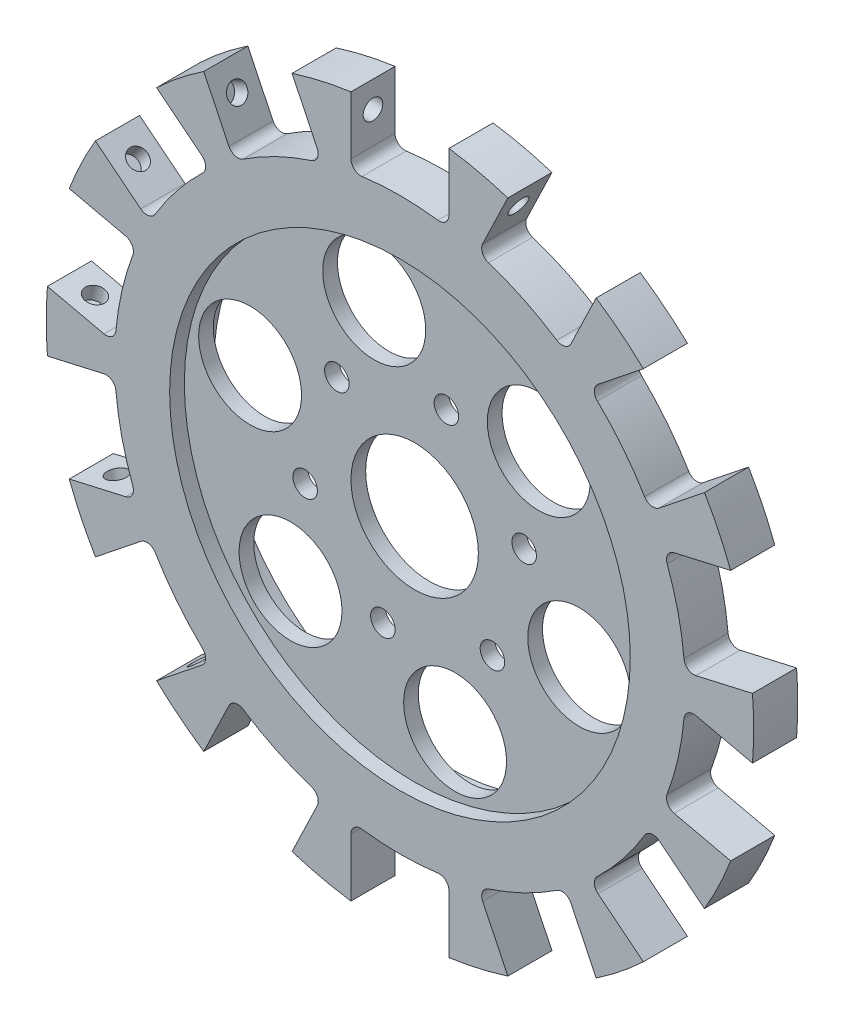
from build123d import *

# Parameters (mm, degrees)
SKETCH_1_R               = 72.2
EXTRUDE_1_DEPTH          = 9
CUT_EXTRUDE_START        = -9
CUT_EXTRUDE_2_DEPTH      = 9
SKETCH_3_R               = 47
CUT_EXTRUDE_3_DEPTH      = 3
CUT_EXTRUDE_START_2      = -3
SKETCH_4_R               = 47
CUT_EXTRUDE_4_DEPTH      = 3
SKETCH_6_R               = 2
CUT_EXTRUDE_6_DEPTH      = 3
PATTERN_CIRCULAR_1_COUNT = 14
SKETCH_5_R               = 13
SKETCH_5_R_2             = 2.5
SKETCH_5_R_3             = 10.5
CUT_EXTRUDE_7_DEPTH      = 102.792337629


with BuildPart() as part:
    # 草图1 → 凸台-拉伸1 (new body)
    with BuildSketch(Plane.XY):
        Circle(SKETCH_1_R)
    extrude(amount=EXTRUDE_1_DEPTH)

    # 草图2 → 切除-拉伸2 (cut)
    with BuildSketch(Plane.XY.offset(9).offset(CUT_EXTRUDE_START)):
        with BuildLine():
            Line((-10, 71.504125755), (-10, 59.666070761))
            ThreePointArc((-10, 59.666070761), (-9.316897592, 58.160819708), (-7.734219269, 57.683809273))
            ThreePointArc((-7.734219269, 57.683809273), (0, 58.2), (7.734219269, 57.683809273))
            ThreePointArc((7.734219269, 57.683809273), (9.316897592, 58.160819708), (10, 59.666070761))
            Line((10, 59.666070761), (10, 71.504125755))
            ThreePointArc((10, 71.504125755), (0, 72.2), (-10, 71.504125755))
        make_face()
        with BuildLine():
            Line((22.014788766, 68.761828623), (16.878449201, 58.096109616))
            ThreePointArc((16.878449201, 58.096109616), (16.840799249, 56.443538253), (18.059776075, 55.327068313))
            ThreePointArc((18.059776075, 55.327068313), (25.252033617, 52.436388112), (31.996357633, 48.615564362))
            ThreePointArc((31.996357633, 48.615564362), (33.629268601, 48.358637524), (34.897826559, 49.418434834))
            Line((34.897826559, 49.418434834), (40.034166124, 60.084153841))
            ThreePointArc((40.034166124, 60.084153841), (31.326405964, 65.049952263), (22.014788766, 68.761828623))
        make_face()
        with BuildLine():
            Line((49.669278623, 52.400408024), (40.413914537, 45.019501461))
            ThreePointArc((40.413914537, 45.019501461), (39.66296926, 43.546921812), (40.276811279, 42.012122931))
            ThreePointArc((40.276811279, 42.012122931), (45.50259228, 36.287106468), (49.921224958, 29.918410697))
            ThreePointArc((49.921224958, 29.918410697), (51.280950528, 28.978434099), (52.883710574, 29.382871811))
            Line((52.883710574, 29.382871811), (62.13907466, 36.763778374))
            ThreePointArc((62.13907466, 36.763778374), (56.448233034, 45.015963694), (49.669278623, 52.400408024))
        make_face()
        with BuildLine():
            Line((67.486158695, 25.660443967), (55.944908455, 23.026228913))
            ThreePointArc((55.944908455, 23.026228913), (54.629401775, 22.025303439), (54.516530046, 20.376161358))
            ThreePointArc((54.516530046, 20.376161358), (56.740804489, 12.950718356), (57.958581437, 5.295548869))
            ThreePointArc((57.958581437, 5.295548869), (58.775811283, 3.858696403), (60.395327134, 3.527670669))
            Line((60.395327134, 3.527670669), (71.936577374, 6.161885723))
            ThreePointArc((71.936577374, 6.161885723), (70.38979526, 16.066011432), (67.486158695, 25.660443967))
        make_face()
        with BuildLine():
            Line((71.936577374, -6.161885723), (60.395327134, -3.527670669))
            ThreePointArc((60.395327134, -3.527670669), (58.775811283, -3.858696403), (57.958581437, -5.295548869))
            ThreePointArc((57.958581437, -5.295548869), (56.740804489, -12.950718356), (54.516530046, -20.376161358))
            ThreePointArc((54.516530046, -20.376161358), (54.629401775, -22.025303439), (55.944908455, -23.026228913))
            Line((55.944908455, -23.026228913), (67.486158695, -25.660443967))
            ThreePointArc((67.486158695, -25.660443967), (70.38979526, -16.066011432), (71.936577374, -6.161885723))
        make_face()
        with BuildLine():
            Line((62.13907466, -36.763778374), (52.883710574, -29.382871811))
            ThreePointArc((52.883710574, -29.382871811), (51.280950528, -28.978434099), (49.921224958, -29.918410697))
            ThreePointArc((49.921224958, -29.918410697), (45.50259228, -36.287106468), (40.276811279, -42.012122931))
            ThreePointArc((40.276811279, -42.012122931), (39.66296926, -43.546921812), (40.413914537, -45.019501461))
            Line((40.413914537, -45.019501461), (49.669278623, -52.400408024))
            ThreePointArc((49.669278623, -52.400408024), (56.448233034, -45.015963694), (62.13907466, -36.763778374))
        make_face()
        with BuildLine():
            Line((40.034166124, -60.084153841), (34.897826559, -49.418434834))
            ThreePointArc((34.897826559, -49.418434834), (33.629268601, -48.358637524), (31.996357633, -48.615564362))
            ThreePointArc((31.996357633, -48.615564362), (25.252033617, -52.436388112), (18.059776075, -55.327068313))
            ThreePointArc((18.059776075, -55.327068313), (16.840799249, -56.443538253), (16.878449201, -58.096109616))
            Line((16.878449201, -58.096109616), (22.014788766, -68.761828623))
            ThreePointArc((22.014788766, -68.761828623), (31.326405964, -65.049952263), (40.034166124, -60.084153841))
        make_face()
        with BuildLine():
            Line((10, -71.504125755), (10, -59.666070761))
            ThreePointArc((10, -59.666070761), (9.316897592, -58.160819708), (7.734219269, -57.683809273))
            ThreePointArc((7.734219269, -57.683809273), (0, -58.2), (-7.734219269, -57.683809273))
            ThreePointArc((-7.734219269, -57.683809273), (-9.316897592, -58.160819708), (-10, -59.666070761))
            Line((-10, -59.666070761), (-10, -71.504125755))
            ThreePointArc((-10, -71.504125755), (0, -72.2), (10, -71.504125755))
        make_face()
        with BuildLine():
            Line((-22.014788766, -68.761828623), (-16.878449201, -58.096109616))
            ThreePointArc((-16.878449201, -58.096109616), (-16.840799249, -56.443538253), (-18.059776075, -55.327068313))
            ThreePointArc((-18.059776075, -55.327068313), (-25.252033617, -52.436388112), (-31.996357633, -48.615564362))
            ThreePointArc((-31.996357633, -48.615564362), (-33.629268601, -48.358637524), (-34.897826559, -49.418434834))
            Line((-34.897826559, -49.418434834), (-40.034166124, -60.084153841))
            ThreePointArc((-40.034166124, -60.084153841), (-31.326405964, -65.049952263), (-22.014788766, -68.761828623))
        make_face()
        with BuildLine():
            Line((-49.669278623, -52.400408024), (-40.413914537, -45.019501461))
            ThreePointArc((-40.413914537, -45.019501461), (-39.66296926, -43.546921812), (-40.276811279, -42.012122931))
            ThreePointArc((-40.276811279, -42.012122931), (-45.50259228, -36.287106468), (-49.921224958, -29.918410697))
            ThreePointArc((-49.921224958, -29.918410697), (-51.280950528, -28.978434099), (-52.883710574, -29.382871811))
            Line((-52.883710574, -29.382871811), (-62.13907466, -36.763778374))
            ThreePointArc((-62.13907466, -36.763778374), (-56.448233034, -45.015963694), (-49.669278623, -52.400408024))
        make_face()
        with BuildLine():
            Line((-67.486158695, -25.660443967), (-55.944908455, -23.026228913))
            ThreePointArc((-55.944908455, -23.026228913), (-54.629401775, -22.025303439), (-54.516530046, -20.376161358))
            ThreePointArc((-54.516530046, -20.376161358), (-56.740804489, -12.950718356), (-57.958581437, -5.295548869))
            ThreePointArc((-57.958581437, -5.295548869), (-58.775811283, -3.858696403), (-60.395327134, -3.527670669))
            Line((-60.395327134, -3.527670669), (-71.936577374, -6.161885723))
            ThreePointArc((-71.936577374, -6.161885723), (-70.38979526, -16.066011432), (-67.486158695, -25.660443967))
        make_face()
        with BuildLine():
            Line((-71.936577374, 6.161885723), (-60.395327134, 3.527670669))
            ThreePointArc((-60.395327134, 3.527670669), (-58.775811283, 3.858696403), (-57.958581437, 5.295548869))
            ThreePointArc((-57.958581437, 5.295548869), (-56.740804489, 12.950718356), (-54.516530046, 20.376161358))
            ThreePointArc((-54.516530046, 20.376161358), (-54.629401775, 22.025303439), (-55.944908455, 23.026228913))
            Line((-55.944908455, 23.026228913), (-67.486158695, 25.660443967))
            ThreePointArc((-67.486158695, 25.660443967), (-70.38979526, 16.066011432), (-71.936577374, 6.161885723))
        make_face()
        with BuildLine():
            Line((-62.13907466, 36.763778374), (-52.883710574, 29.382871811))
            ThreePointArc((-52.883710574, 29.382871811), (-51.280950528, 28.978434099), (-49.921224958, 29.918410697))
            ThreePointArc((-49.921224958, 29.918410697), (-45.50259228, 36.287106468), (-40.276811279, 42.012122931))
            ThreePointArc((-40.276811279, 42.012122931), (-39.66296926, 43.546921812), (-40.413914537, 45.019501461))
            Line((-40.413914537, 45.019501461), (-49.669278623, 52.400408024))
            ThreePointArc((-49.669278623, 52.400408024), (-56.448233034, 45.015963694), (-62.13907466, 36.763778374))
        make_face()
        with BuildLine():
            Line((-40.034166124, 60.084153841), (-34.897826559, 49.418434834))
            ThreePointArc((-34.897826559, 49.418434834), (-33.629268601, 48.358637524), (-31.996357633, 48.615564362))
            ThreePointArc((-31.996357633, 48.615564362), (-25.252033617, 52.436388112), (-18.059776075, 55.327068313))
            ThreePointArc((-18.059776075, 55.327068313), (-16.840799249, 56.443538253), (-16.878449201, 58.096109616))
            Line((-16.878449201, 58.096109616), (-22.014788766, 68.761828623))
            ThreePointArc((-22.014788766, 68.761828623), (-31.326405964, 65.049952263), (-40.034166124, 60.084153841))
        make_face()
    extrude(amount=CUT_EXTRUDE_2_DEPTH, mode=Mode.SUBTRACT)

    # 草图3 → 切除-拉伸3 (cut)
    with BuildSketch(Plane.XY.offset(9)):
        Circle(SKETCH_3_R)
    extrude(amount=-CUT_EXTRUDE_3_DEPTH, mode=Mode.SUBTRACT)

    # 草图4 → 切除-拉伸4 (cut)
    with BuildSketch(Plane(origin=(0, 0, 0), x_dir=(-1, 0, 0), z_dir=(0, 0, -1)).offset(CUT_EXTRUDE_START_2)):
        with Locations(Location((0, 0, 0), (0, 0, 180))):
            Circle(SKETCH_4_R)
    extrude(amount=CUT_EXTRUDE_4_DEPTH, mode=Mode.SUBTRACT)

    # 草图6 → 切除-拉伸6 (cut)
    with BuildSketch(Plane(origin=(-10, 0, 0), x_dir=(0, 0, -1), z_dir=(1, 0, 0))):
        with Locations((-4.5, 66.154125755)):
            Circle(SKETCH_6_R)
    cut_extrude_6 = extrude(amount=-CUT_EXTRUDE_6_DEPTH, mode=Mode.SUBTRACT)

    # 阵列(圆周)1: 切除-拉伸6 ×14 about axis
    pattern_circular_1_axis = Axis((0, 0, 0), (0, 0, 1))
    for i in range(1, PATTERN_CIRCULAR_1_COUNT):
        add(cut_extrude_6.rotate(pattern_circular_1_axis, i * 360 / PATTERN_CIRCULAR_1_COUNT), mode=Mode.SUBTRACT)

    # 草图5 → 切除-拉伸7 (cut, through all)
    with BuildSketch(Plane(origin=(0, 0, 3), x_dir=(-1, 0, 0), z_dir=(0, 0, -1))):
        Circle(SKETCH_5_R)
        with Locations((-6.479848807, 22.068338393)):
            Circle(SKETCH_5_R_2)
        with Locations((15.871817264, 16.645882876)):
            Circle(SKETCH_5_R_2)
        with Locations((22.351666071, -5.422455517)):
            Circle(SKETCH_5_R_2)
        with Locations((6.479848807, -22.068338393)):
            Circle(SKETCH_5_R_2)
        with Locations((-15.871817264, -16.645882876)):
            Circle(SKETCH_5_R_2)
        with Locations((-22.351666071, 5.422455517)):
            Circle(SKETCH_5_R_2)
        with Locations((8.251562743, 34.013404891)):
            Circle(SKETCH_5_R_3)
        with Locations((33.582254077, 9.860639489)):
            Circle(SKETCH_5_R_3)
        with Locations((25.330691334, -24.152765402)):
            Circle(SKETCH_5_R_3)
        with Locations((-8.251562743, -34.013404891)):
            Circle(SKETCH_5_R_3)
        with Locations((-33.582254077, -9.860639489)):
            Circle(SKETCH_5_R_3)
        with Locations((-25.330691334, 24.152765402)):
            Circle(SKETCH_5_R_3)
    extrude(amount=-CUT_EXTRUDE_7_DEPTH, mode=Mode.SUBTRACT)


solid = part.part
